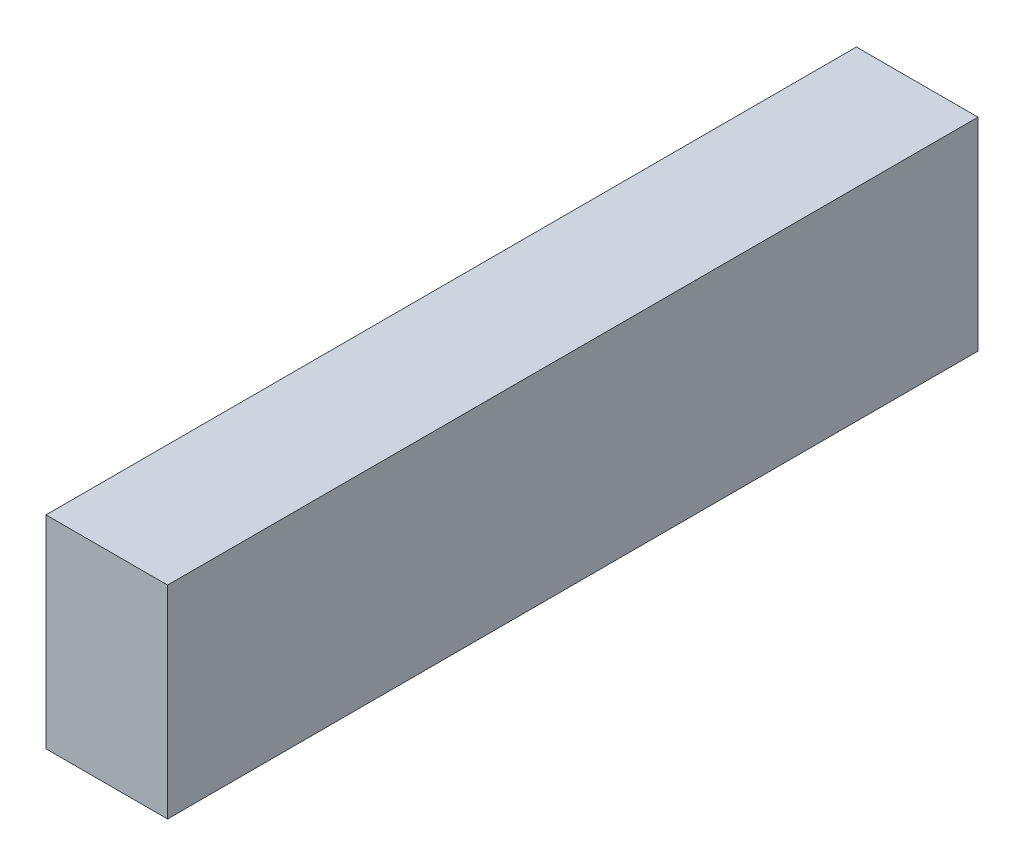
from build123d import *

# Parameters (mm, degrees)
SKETCH1_W           = 30
SKETCH1_H           = 50
BOSS_EXTRUDE1_DEPTH = 200


with BuildPart() as part:
    # Sketch1 → Boss-Extrude1 (new body)
    with BuildSketch(Plane.XY):
        Rectangle(SKETCH1_W, SKETCH1_H)
    extrude(amount=BOSS_EXTRUDE1_DEPTH)


solid = part.part
